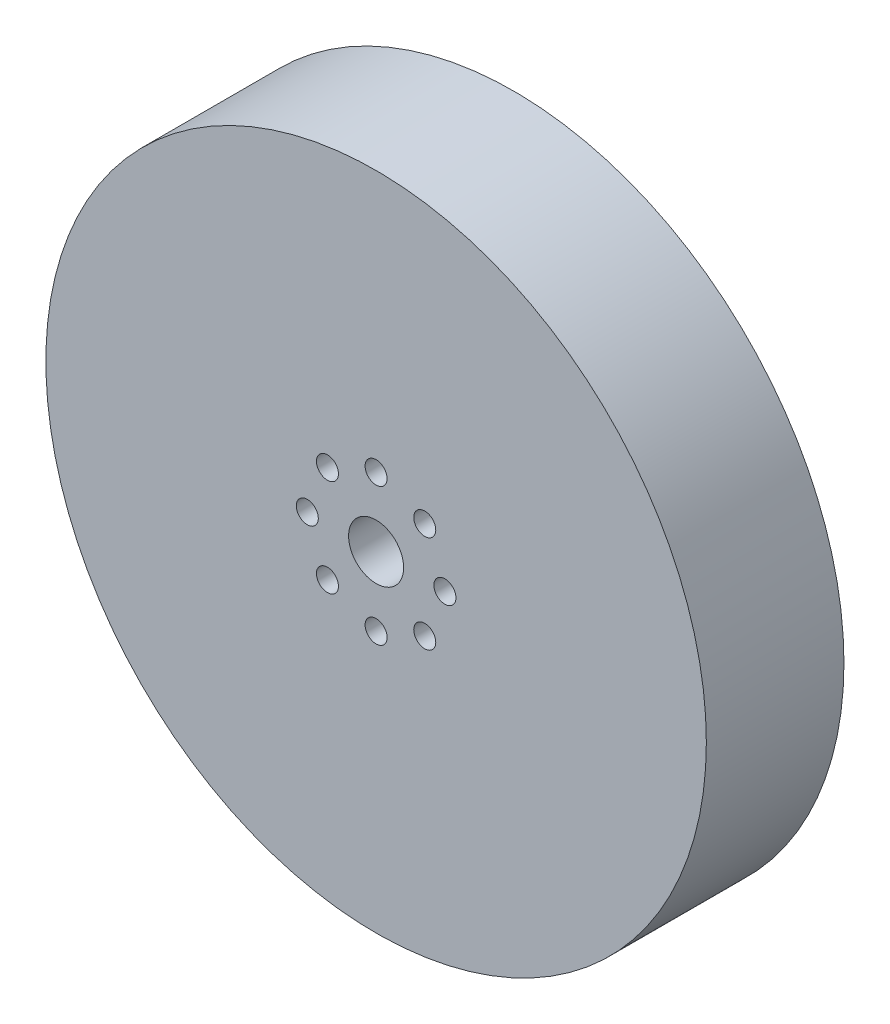
from build123d import *

# Parameters (mm, degrees)
SKETCH1_R           = 48
BOSS_EXTRUDE1_DEPTH = 20
CUT_EXTRUDE1_REACH  = 72.767
SKETCH2_R           = 4
SKETCH2_R_2         = 1.6


with BuildPart() as part:
    # Sketch1 → Boss-Extrude1 (new body)
    with BuildSketch(Plane.XY):
        Circle(SKETCH1_R)
    extrude(amount=BOSS_EXTRUDE1_DEPTH)

    # Sketch2 → Cut-Extrude1 (cut, up to next)
    with BuildSketch(Plane(origin=(0, 0, 0), x_dir=(-1, 0, 0), z_dir=(0, 0, -1)), mode=Mode.PRIVATE) as cut_extrude1_sk1:
        Circle(SKETCH2_R)
    cut_extrude1_tool1 = extrude(cut_extrude1_sk1.sketch, amount=-CUT_EXTRUDE1_REACH, mode=Mode.PRIVATE) & part.part
    # Sketch2 → Cut-Extrude1 (cut, up to next)
    with BuildSketch(Plane(origin=(0, 0, 0), x_dir=(-1, 0, 0), z_dir=(0, 0, -1)), mode=Mode.PRIVATE) as cut_extrude1_sk2:
        with Locations((0, 10)):
            Circle(SKETCH2_R_2)
    cut_extrude1_tool2 = extrude(cut_extrude1_sk2.sketch, amount=-CUT_EXTRUDE1_REACH, mode=Mode.PRIVATE) & part.part
    # Sketch2 → Cut-Extrude1 (cut, up to next)
    with BuildSketch(Plane(origin=(0, 0, 0), x_dir=(-1, 0, 0), z_dir=(0, 0, -1)), mode=Mode.PRIVATE) as cut_extrude1_sk3:
        with Locations((7.071067812, 7.071067812)):
            Circle(SKETCH2_R_2)
    cut_extrude1_tool3 = extrude(cut_extrude1_sk3.sketch, amount=-CUT_EXTRUDE1_REACH, mode=Mode.PRIVATE) & part.part
    # Sketch2 → Cut-Extrude1 (cut, up to next)
    with BuildSketch(Plane(origin=(0, 0, 0), x_dir=(-1, 0, 0), z_dir=(0, 0, -1)), mode=Mode.PRIVATE) as cut_extrude1_sk4:
        with Locations((10, 0)):
            Circle(SKETCH2_R_2)
    cut_extrude1_tool4 = extrude(cut_extrude1_sk4.sketch, amount=-CUT_EXTRUDE1_REACH, mode=Mode.PRIVATE) & part.part
    # Sketch2 → Cut-Extrude1 (cut, up to next)
    with BuildSketch(Plane(origin=(0, 0, 0), x_dir=(-1, 0, 0), z_dir=(0, 0, -1)), mode=Mode.PRIVATE) as cut_extrude1_sk5:
        with Locations((7.071067812, -7.071067812)):
            Circle(SKETCH2_R_2)
    cut_extrude1_tool5 = extrude(cut_extrude1_sk5.sketch, amount=-CUT_EXTRUDE1_REACH, mode=Mode.PRIVATE) & part.part
    # Sketch2 → Cut-Extrude1 (cut, up to next)
    with BuildSketch(Plane(origin=(0, 0, 0), x_dir=(-1, 0, 0), z_dir=(0, 0, -1)), mode=Mode.PRIVATE) as cut_extrude1_sk6:
        with Locations((0, -10)):
            Circle(SKETCH2_R_2)
    cut_extrude1_tool6 = extrude(cut_extrude1_sk6.sketch, amount=-CUT_EXTRUDE1_REACH, mode=Mode.PRIVATE) & part.part
    # Sketch2 → Cut-Extrude1 (cut, up to next)
    with BuildSketch(Plane(origin=(0, 0, 0), x_dir=(-1, 0, 0), z_dir=(0, 0, -1)), mode=Mode.PRIVATE) as cut_extrude1_sk7:
        with Locations((-7.071067812, -7.071067812)):
            Circle(SKETCH2_R_2)
    cut_extrude1_tool7 = extrude(cut_extrude1_sk7.sketch, amount=-CUT_EXTRUDE1_REACH, mode=Mode.PRIVATE) & part.part
    # Sketch2 → Cut-Extrude1 (cut, up to next)
    with BuildSketch(Plane(origin=(0, 0, 0), x_dir=(-1, 0, 0), z_dir=(0, 0, -1)), mode=Mode.PRIVATE) as cut_extrude1_sk8:
        with Locations((-10, 0)):
            Circle(SKETCH2_R_2)
    cut_extrude1_tool8 = extrude(cut_extrude1_sk8.sketch, amount=-CUT_EXTRUDE1_REACH, mode=Mode.PRIVATE) & part.part
    # Sketch2 → Cut-Extrude1 (cut, up to next)
    with BuildSketch(Plane(origin=(0, 0, 0), x_dir=(-1, 0, 0), z_dir=(0, 0, -1)), mode=Mode.PRIVATE) as cut_extrude1_sk9:
        with Locations((-7.071067812, 7.071067812)):
            Circle(SKETCH2_R_2)
    cut_extrude1_tool9 = extrude(cut_extrude1_sk9.sketch, amount=-CUT_EXTRUDE1_REACH, mode=Mode.PRIVATE) & part.part
    add(cut_extrude1_tool1.solids().sort_by_distance((0, 0, 0))[0], mode=Mode.SUBTRACT)
    add(cut_extrude1_tool2.solids().sort_by_distance((0, 10, 0))[0], mode=Mode.SUBTRACT)
    add(cut_extrude1_tool3.solids().sort_by_distance((-7.071068, 7.071068, 0))[0], mode=Mode.SUBTRACT)
    add(cut_extrude1_tool4.solids().sort_by_distance((-10, 0, 0))[0], mode=Mode.SUBTRACT)
    add(cut_extrude1_tool5.solids().sort_by_distance((-7.071068, -7.071068, 0))[0], mode=Mode.SUBTRACT)
    add(cut_extrude1_tool6.solids().sort_by_distance((0, -10, 0))[0], mode=Mode.SUBTRACT)
    add(cut_extrude1_tool7.solids().sort_by_distance((7.071068, -7.071068, 0))[0], mode=Mode.SUBTRACT)
    add(cut_extrude1_tool8.solids().sort_by_distance((10, 0, 0))[0], mode=Mode.SUBTRACT)
    add(cut_extrude1_tool9.solids().sort_by_distance((7.071068, 7.071068, 0))[0], mode=Mode.SUBTRACT)


solid = part.part
